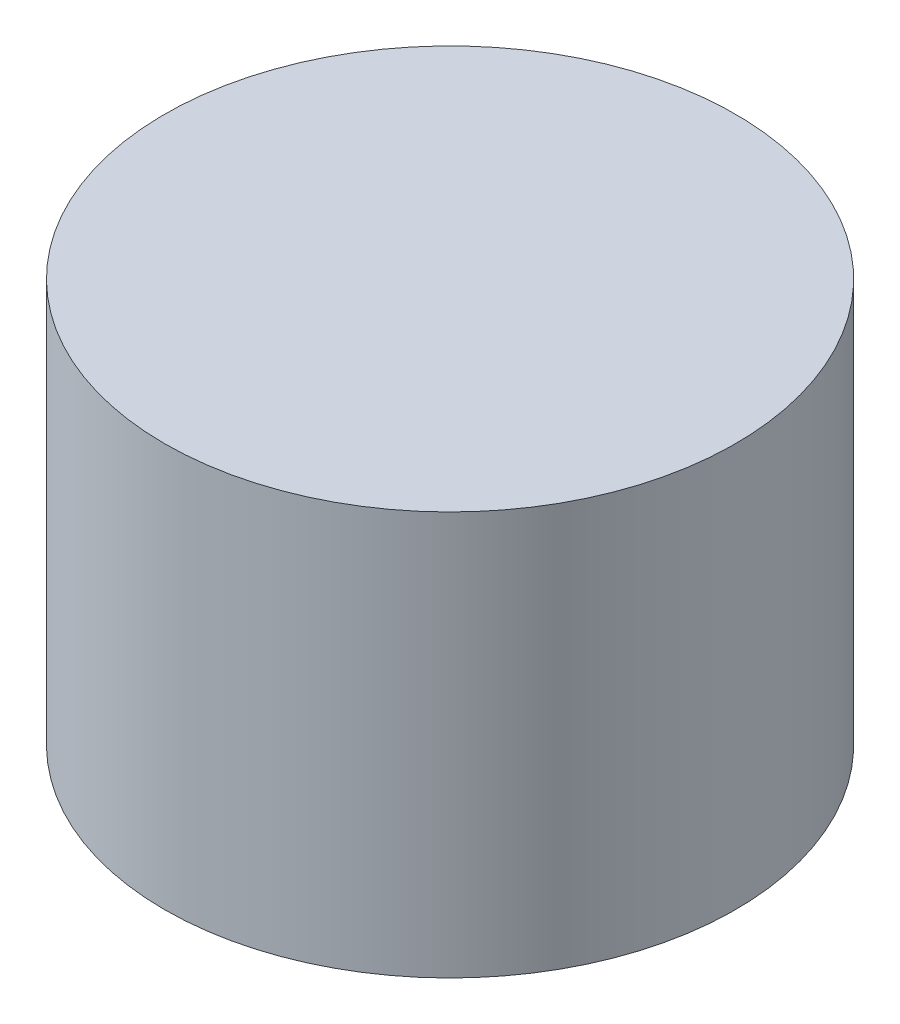
from build123d import *

# Parameters (mm, degrees)
SKETCH1_R           = 0.99
BOSS_EXTRUDE1_DEPTH = 1.4


with BuildPart() as part:
    # Sketch1 → Boss-Extrude1 (new body)
    with BuildSketch(Plane(origin=(0, 0, 0), x_dir=(1, 0, 0), z_dir=(0, 1, 0))):
        with Locations(Location((0, 0, 0), (0, 0, 270))):
            Circle(SKETCH1_R)
    extrude(amount=BOSS_EXTRUDE1_DEPTH)


solid = part.part
